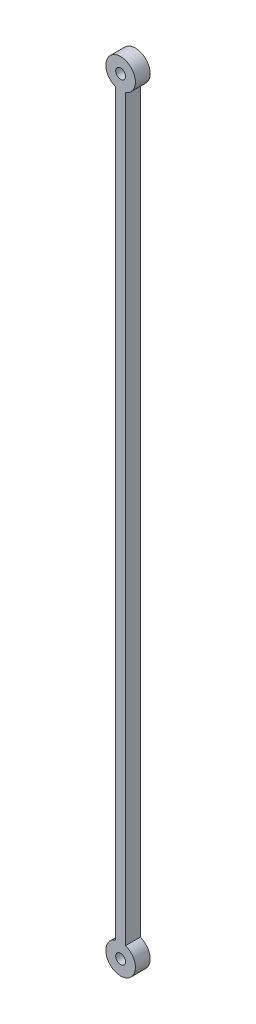
from build123d import *

# Parameters (mm, degrees)
EXTRUDE_3_DEPTH     = 3
SKETCH_3_R          = 1
CUT_EXTRUDE_1_DEPTH = 3


with BuildPart() as part:
    # 草图1 → 凸台-拉伸3 (new body)
    with BuildSketch(Plane.XY):
        with BuildLine():
            Line((1, 2.828427125), (1, 152.828427125))
            ThreePointArc((1, 152.828427125), (0, 158.656854249), (-1, 152.828427125))
            Line((-1, 152.828427125), (-1, 2.828427125))
            ThreePointArc((-1, 2.828427125), (0, -3), (1, 2.828427125))
        make_face()
    extrude(amount=EXTRUDE_3_DEPTH)

    # 草图3 → 切除-拉伸1 (cut)
    with BuildSketch(Plane.XY.offset(3)):
        Circle(SKETCH_3_R)
        with Locations((0, 155.656854249)):
            Circle(SKETCH_3_R)
    extrude(amount=-CUT_EXTRUDE_1_DEPTH, mode=Mode.SUBTRACT)


solid = part.part
